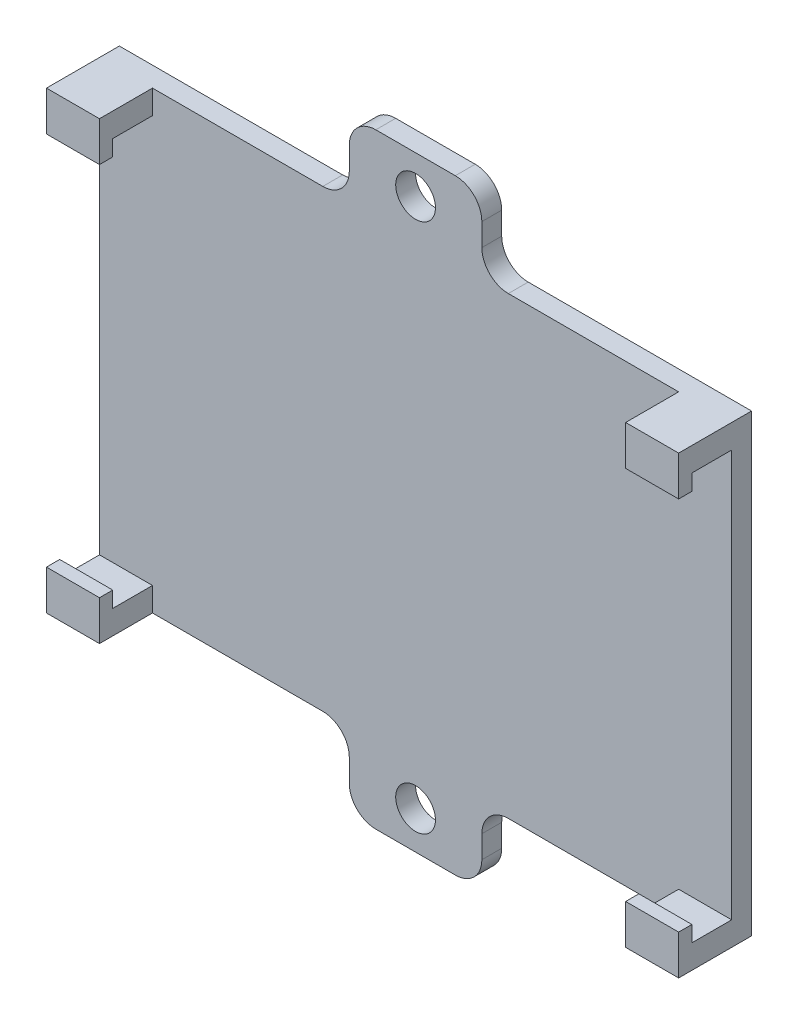
from build123d import *

# Parameters (mm, degrees)
SKETCH1_W             = 47.7
SKETCH1_H             = 45.7
BOSS_EXTRUDE1_DEPTH   = 1.5
SKETCH2_W             = 47.7
SKETCH2_H             = 3
BOSS_EXTRUDE2_DEPTH   = 4
SKETCH3_W             = 47.7
SKETCH3_H             = 3
CUT_EXTRUDE1_DEPTH    = 1.2
SKETCH4_W             = 47.7
SKETCH4_H             = 3
CUT_EXTRUDE2_DEPTH    = 1.2
SKETCH5_R             = 1.5
CUT_EXTRUDE3_DEPTH    = 67.179906316
SKETCH8_W             = 39.7
SKETCH8_H             = 4
CUT_EXTRUDE5_DEPTH    = 63.494319742
SKETCH9_W             = 18.85
SKETCH9_H             = 5.7
CUT_EXTRUDE6_DEPTH    = 67.179906316
FILLET1_R             = 2
BODY_MOVE_COPY1_ANGLE = 90


with BuildPart() as part:
    # Sketch1 → Boss-Extrude1 (new body)
    with BuildSketch(Plane(origin=(0, 0, 0), x_dir=(1, 0, 0), z_dir=(0, 1, 0))):
        with Locations((23.85, 22.85)):
            Rectangle(SKETCH1_W, SKETCH1_H)
    extrude(amount=BOSS_EXTRUDE1_DEPTH)

    # Sketch2 → Boss-Extrude2 (add)
    with BuildSketch(Plane(origin=(0, 1.5, 0), x_dir=(1, 0, 0), z_dir=(0, 1, 0))):
        with Locations((23.85, 38.5)):
            Rectangle(SKETCH2_W, SKETCH2_H)
        with Locations((23.85, 7.2)):
            Rectangle(SKETCH2_W, SKETCH2_H)
    extrude(amount=BOSS_EXTRUDE2_DEPTH)

    # Sketch3 → Cut-Extrude1 (cut)
    with BuildSketch(Plane.XY.offset(-37)):
        with Locations((23.85, 3)):
            Rectangle(SKETCH3_W, SKETCH3_H)
    extrude(amount=-CUT_EXTRUDE1_DEPTH, mode=Mode.SUBTRACT)

    # Sketch4 → Cut-Extrude2 (cut)
    with BuildSketch(Plane(origin=(0, 0, -8.7), x_dir=(-1, 0, 0), z_dir=(0, 0, -1))):
        with Locations((-23.85, 3)):
            Rectangle(SKETCH4_W, SKETCH4_H)
    extrude(amount=-CUT_EXTRUDE2_DEPTH, mode=Mode.SUBTRACT)

    # Sketch5 → Cut-Extrude3 (cut, through all)
    with BuildSketch(Plane(origin=(0, 1.5, 0), x_dir=(1, 0, 0), z_dir=(0, 1, 0))):
        with Locations(Location((23.85, 42.85, 0), (0, 0, 270))):
            Circle(SKETCH5_R)
        with Locations(Location((23.85, 2.85, 0), (0, 0, 270))):
            Circle(SKETCH5_R)
    extrude(amount=-CUT_EXTRUDE3_DEPTH, mode=Mode.SUBTRACT)

    # Sketch8 → Cut-Extrude5 (cut, through all)
    with BuildSketch(Plane.XY.offset(-5.7)):
        with Locations((23.85, 3.5)):
            Rectangle(SKETCH8_W, SKETCH8_H)
    extrude(amount=-CUT_EXTRUDE5_DEPTH, mode=Mode.SUBTRACT)

    # Sketch9 → Cut-Extrude6 (cut, through all)
    with BuildSketch(Plane(origin=(0, 1.5, 0), x_dir=(1, 0, 0), z_dir=(0, 1, 0))):
        with Locations((9.425, 42.85)):
            Rectangle(SKETCH9_W, SKETCH9_H)
        with Locations((38.275, 42.85)):
            Rectangle(SKETCH9_W, SKETCH9_H)
        with Locations((38.275, 2.85)):
            Rectangle(SKETCH9_W, SKETCH9_H)
        with Locations((9.425, 2.85)):
            Rectangle(SKETCH9_W, SKETCH9_H)
    extrude(amount=-CUT_EXTRUDE6_DEPTH, mode=Mode.SUBTRACT)

    # Fillet1
    fillet1_edges = [part.edges().sort_by_distance(p)[0] for p in [
        (18.85, 0.75, 0),
        (18.85, 0.75, -5.7),
        (28.85, 0.75, 0),
        (28.85, 0.75, -5.7),
        (28.85, 0.75, -45.7),
        (28.85, 0.75, -40),
        (18.85, 0.75, -45.7),
        (18.85, 0.75, -40),
    ]]
    fillet(fillet1_edges, radius=FILLET1_R)


with BuildPart() as part_1:
    # Body-Move/Copy1: moved
    add(part.part.rotate(Axis((0, 2.75, -20.7), (1, 0, 0)), BODY_MOVE_COPY1_ANGLE))


solid = part_1.part
